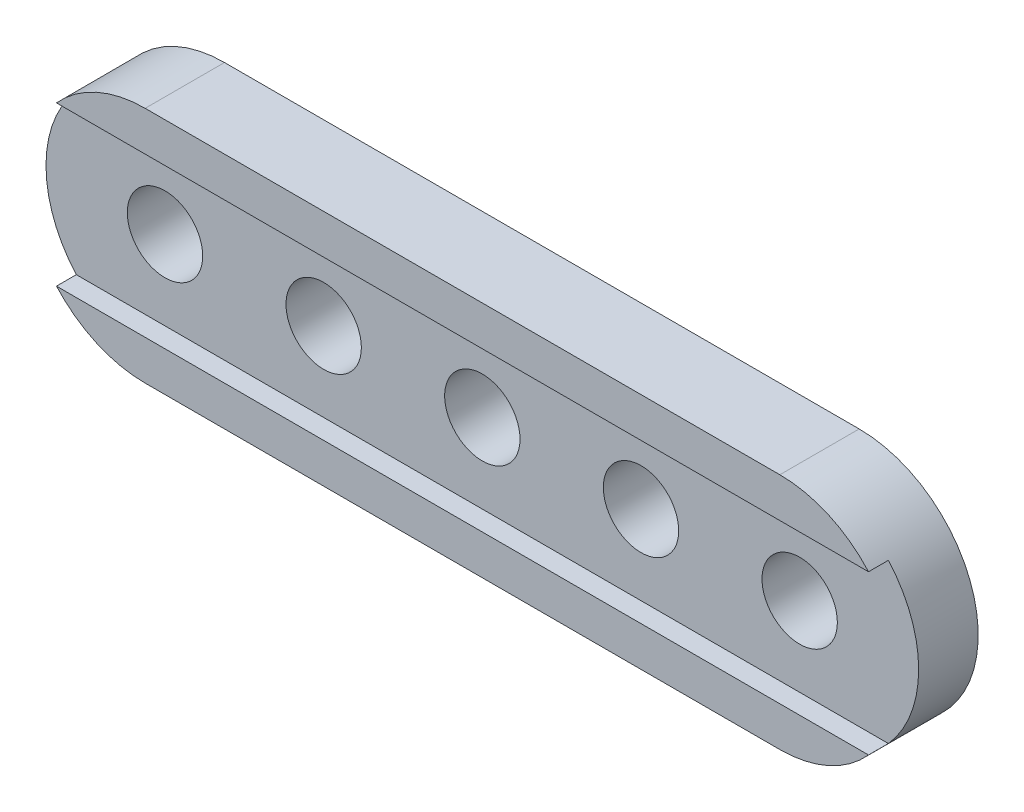
from build123d import *

# Parameters (mm, degrees)
EXTRUDE_1_DEPTH        = 4
SKETCH_2_W             = 44
SKETCH_2_H             = 8
CUT_EXTRUDE_1_DEPTH    = 1
SKETCH_3_R             = 1.9
CUT_EXTRUDE_2_DEPTH    = 3
PATTERN_LINEAR_1_COUNT = 5
PATTERN_LINEAR_1_PITCH = 8


with BuildPart() as part:
    # 草图1 → 凸台-拉伸1 (new body)
    with BuildSketch(Plane.XY):
        with BuildLine():
            Line((-16, 6), (16, 6))
            ThreePointArc((16, 6), (22, 0), (16, -6))
            Line((16, -6), (-16, -6))
            ThreePointArc((-16, -6), (-22, 0), (-16, 6))
        make_face()
    extrude(amount=EXTRUDE_1_DEPTH)

    # 草图2 → 切除-拉伸1 (cut)
    with BuildSketch(Plane.XY.offset(4)):
        Rectangle(SKETCH_2_W, SKETCH_2_H)
    extrude(amount=-CUT_EXTRUDE_1_DEPTH, mode=Mode.SUBTRACT)

    # 草图3 → 切除-拉伸2 (cut)
    with BuildSketch(Plane.XY.offset(3)):
        with Locations((-16, 0)):
            Circle(SKETCH_3_R)
    cut_extrude_2 = extrude(amount=-CUT_EXTRUDE_2_DEPTH, mode=Mode.SUBTRACT)

    # 阵列(线性)1: 切除-拉伸2 ×5
    with Locations(*[(i * PATTERN_LINEAR_1_PITCH, 0, 0) for i in range(1, PATTERN_LINEAR_1_COUNT)]):
        add(cut_extrude_2, mode=Mode.SUBTRACT)


solid = part.part
